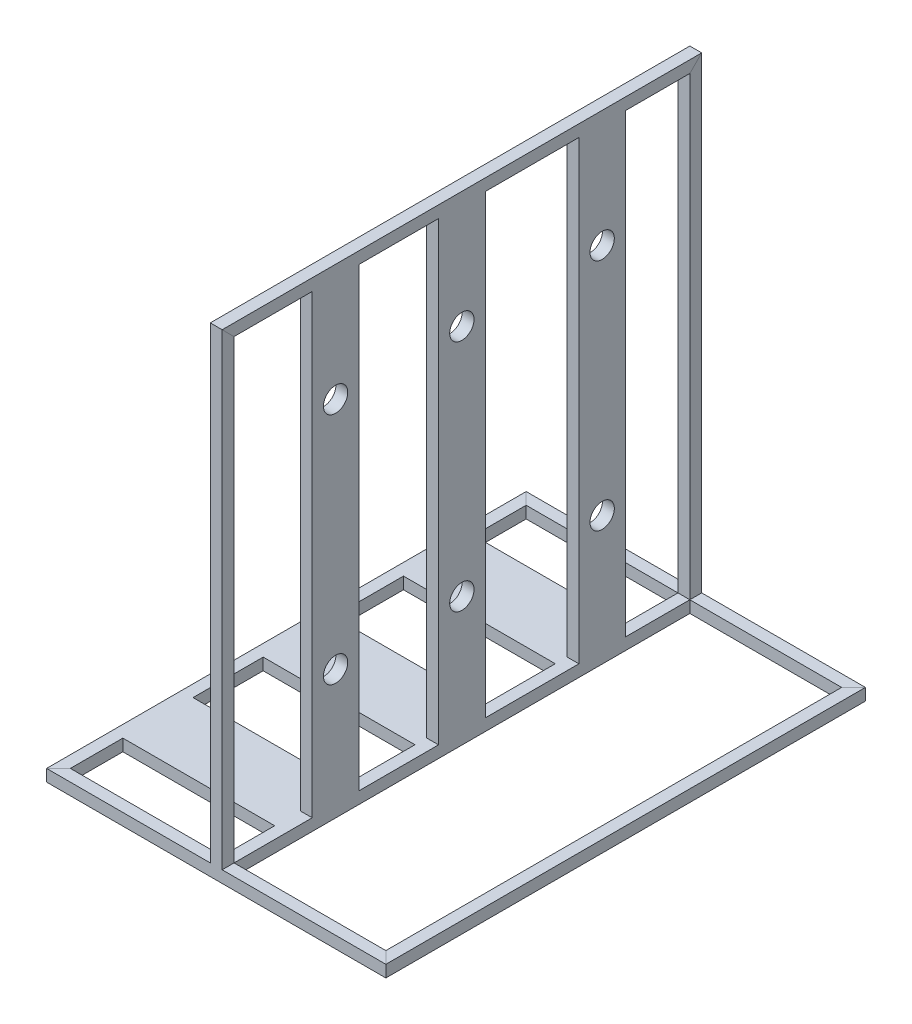
from build123d import *

# Parameters (mm, degrees)
SKETCH2_W           = 25.4
SKETCH2_H           = 25.4
SKETCH6_W           = 25.4
SKETCH6_H           = 25.4
SKETCH7_W           = 25.4
SKETCH7_H           = 100
BOSS_EXTRUDE1_DEPTH = 974.6
SKETCH8_W           = 150
SKETCH8_H           = 25.4
BOSS_EXTRUDE2_DEPTH = 324.6
SKETCH14_R          = 26
CUT_EXTRUDE1_DEPTH  = 1115


with BuildPart() as part:
    # Sweep4: sweep along a path in Sketch1
    with BuildLine(Plane(origin=(0, 0, 0), x_dir=(1, 0, 0), z_dir=(0, 1, 0))) as sweep4_path:
        Line((-350, -500), (350, -500))
        Line((350, -500), (350, 500))
        Line((350, 500), (-350, 500))
        Line((-350, 500), (-350, -500))
    # Sketch2 → Sweep4 (sweep)
    with BuildSketch(Plane(origin=(0, 0, 0), x_dir=(0, 0, -1), z_dir=(1, 0, 0))):
        with Locations((500, 0)):
            Rectangle(SKETCH2_W, SKETCH2_H)
    sweep(path=sweep4_path.line, transition=Transition.RIGHT)

    # Sweep5: sweep along a path in Sketch4
    with BuildLine(Plane(origin=(0, 0, 0), x_dir=(0, 0, -1), z_dir=(1, 0, 0))) as sweep5_path:
        Line((-500, 0), (-500, 1000))
        Line((-500, 1000), (500, 1000))
        Line((500, 1000), (500, 0))
        Line((500, 0), (-500, 0))
    # Sketch6 → Sweep5 (sweep)
    with BuildSketch(Plane(origin=(0, 12.7, 0), x_dir=(1, 0, 0), z_dir=(0, 1, 0))):
        with Locations((0, 500)):
            Rectangle(SKETCH6_W, SKETCH6_H)
    sweep(path=sweep5_path.line, transition=Transition.RIGHT)

    # Sketch7 → Boss-Extrude1 (add)
    with BuildSketch(Plane(origin=(0, 12.7, 0), x_dir=(1, 0, 0), z_dir=(0, 1, 0))):
        Polygon((-12.7, -25), (-12.7, -50), (12.7, -50), (12.7, -25), (12.7, 25), (12.7, 50), (-12.7, 50), (-12.7, 25), align=None)
        with Locations((0, -270.176844268)):
            Rectangle(SKETCH7_W, SKETCH7_H)
        with Locations((0, 300)):
            Rectangle(SKETCH7_W, SKETCH7_H)
    extrude(amount=BOSS_EXTRUDE1_DEPTH)

    # Sketch8 → Boss-Extrude2 (add)
    with BuildSketch(Plane.ZY.offset(12.7)):
        with Locations((-300, 0)):
            Rectangle(SKETCH8_W, SKETCH8_H)
        Rectangle(SKETCH8_W, SKETCH8_H)
        with Locations((300, 0)):
            Rectangle(SKETCH8_W, SKETCH8_H)
    extrude(amount=BOSS_EXTRUDE2_DEPTH)

    # Sketch14 → Cut-Extrude1 (cut)
    with BuildSketch(Plane(origin=(12.7, 0, 0), x_dir=(0, 0, -1), z_dir=(1, 0, 0))):
        with Locations((-270.176844268, 762.7)):
            Circle(SKETCH14_R)
        with Locations((-0.176844268, 762.7)):
            Circle(SKETCH14_R)
        with Locations((299.823155732, 762.7)):
            Circle(SKETCH14_R)
        with Locations((-270.176844268, 262.7)):
            Circle(SKETCH14_R)
        with Locations((-0.176844268, 262.7)):
            Circle(SKETCH14_R)
        with Locations((299.823155732, 262.7)):
            Circle(SKETCH14_R)
    extrude(amount=-CUT_EXTRUDE1_DEPTH, mode=Mode.SUBTRACT)


solid = part.part
